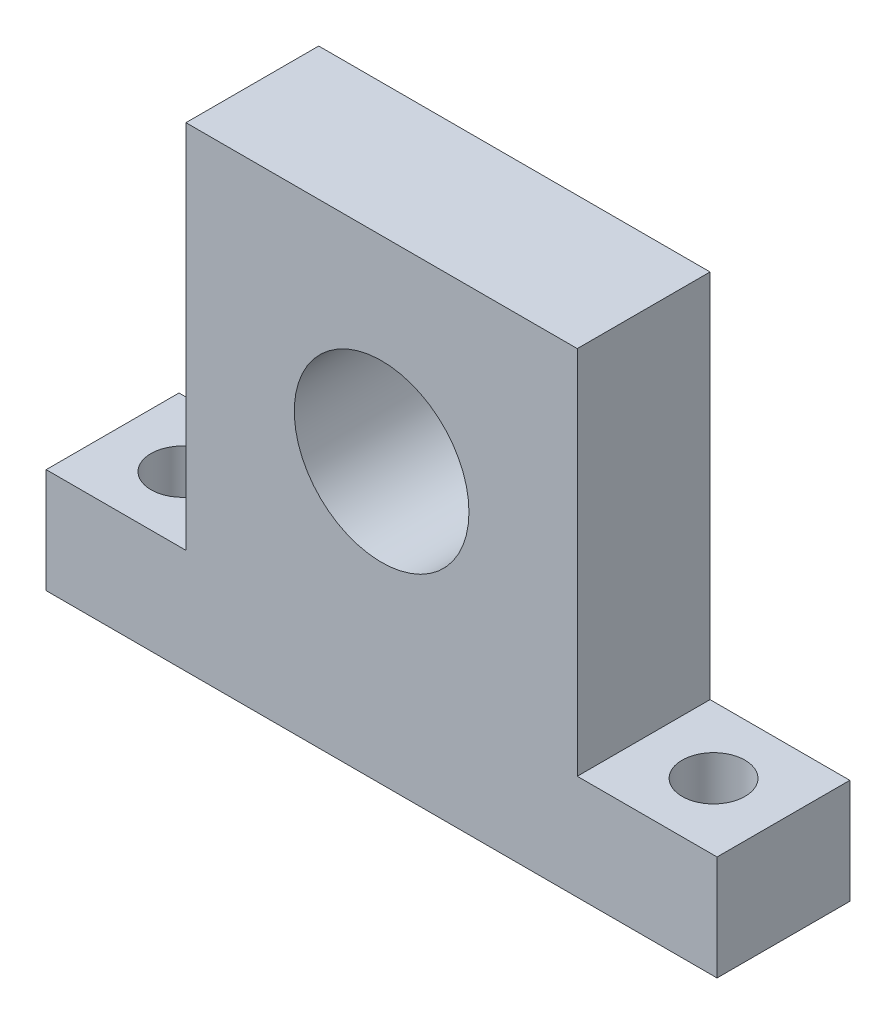
from build123d import *

# Parameters (mm, degrees)
SKETCH_1_R          = 12.5
EXTRUDE_1_DEPTH     = 19
SKETCH_2_R          = 4.5
CUT_EXTRUDE_1_DEPTH = 74.986485252


with BuildPart() as part:
    # 草图1 → 凸台-拉伸1 (new body)
    with BuildSketch(Plane.XY):
        Polygon((-48, -40), (-48, -25), (-28, -25), (-28, 28), (28, 28), (28, -25), (48, -25), (48, -40), align=None)
        Circle(SKETCH_1_R, mode=Mode.SUBTRACT)
    extrude(amount=EXTRUDE_1_DEPTH)

    # 草图2 → 切除-拉伸1 (cut, through all)
    with BuildSketch(Plane(origin=(0, -25, 0), x_dir=(1, 0, 0), z_dir=(0, 1, 0))):
        with Locations(Location((-38, -9.5, 0), (0, 0, 270))):
            Circle(SKETCH_2_R)
        with Locations(Location((38, -9.5, 0), (0, 0, 90))):
            Circle(SKETCH_2_R)
    extrude(amount=-CUT_EXTRUDE_1_DEPTH, mode=Mode.SUBTRACT)


solid = part.part
